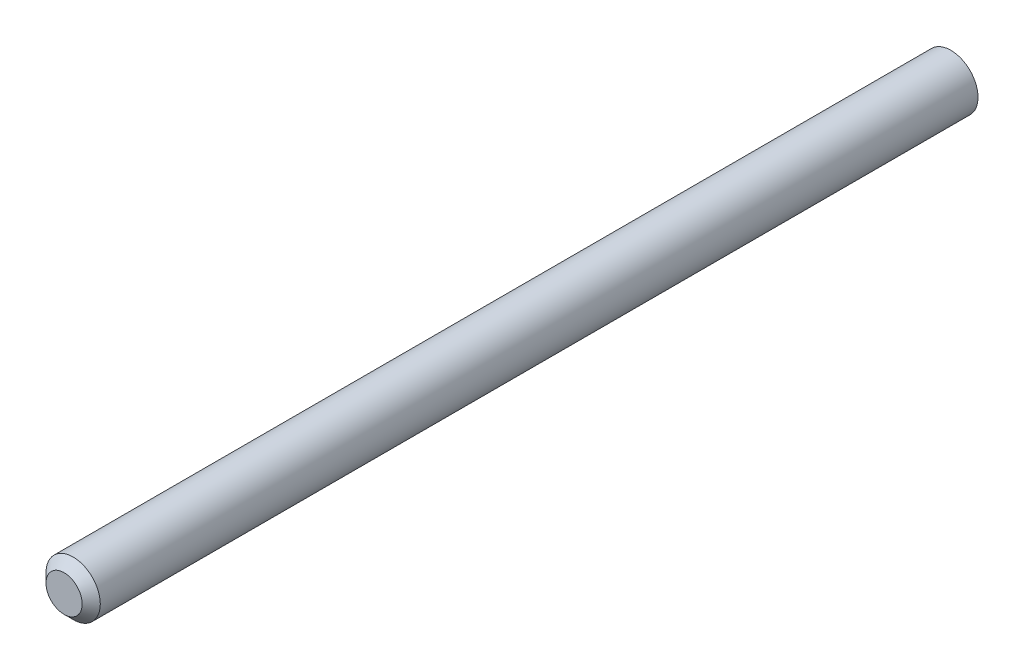
from build123d import *

# Parameters (mm, degrees)
ESQUISSE1_R        = 3
BOSS_EXTRU_1_DEPTH = 98
CHANFREIN1_SIZE    = 1


with BuildPart() as part:
    # Esquisse1 → Boss.-Extru.1 (new body)
    with BuildSketch(Plane.XY):
        Circle(ESQUISSE1_R)
    extrude(amount=BOSS_EXTRU_1_DEPTH)

    # Chanfrein1
    chanfrein1_edges = [part.edges().sort_by_distance(p)[0] for p in [
        (-3, 0, 98),
    ]]
    chamfer(chanfrein1_edges, length=CHANFREIN1_SIZE)


solid = part.part
